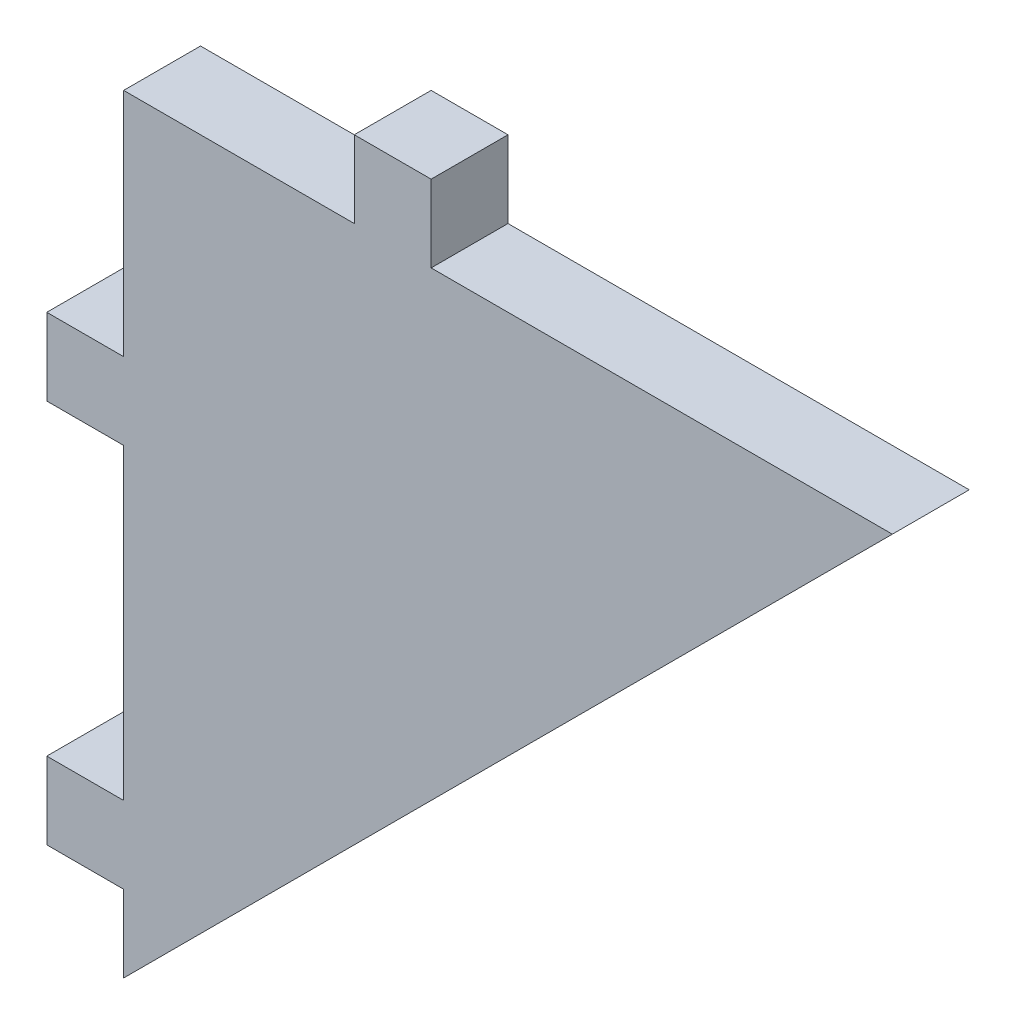
from build123d import *

# Parameters (mm, degrees)
EXTRUDE1_DEPTH = 5


with BuildPart() as part:
    # Sketch1 → Extrude1 (new body)
    with BuildSketch(Plane.XY):
        Polygon((0, 0), (0, 5), (-5, 5), (-5, 10), (0, 10), (0, 30), (-5, 30), (-5, 35), (0, 35), (0, 50), (15, 50), (15, 55), (20, 55), (20, 50), (50, 50), align=None)
    extrude(amount=EXTRUDE1_DEPTH)


solid = part.part
